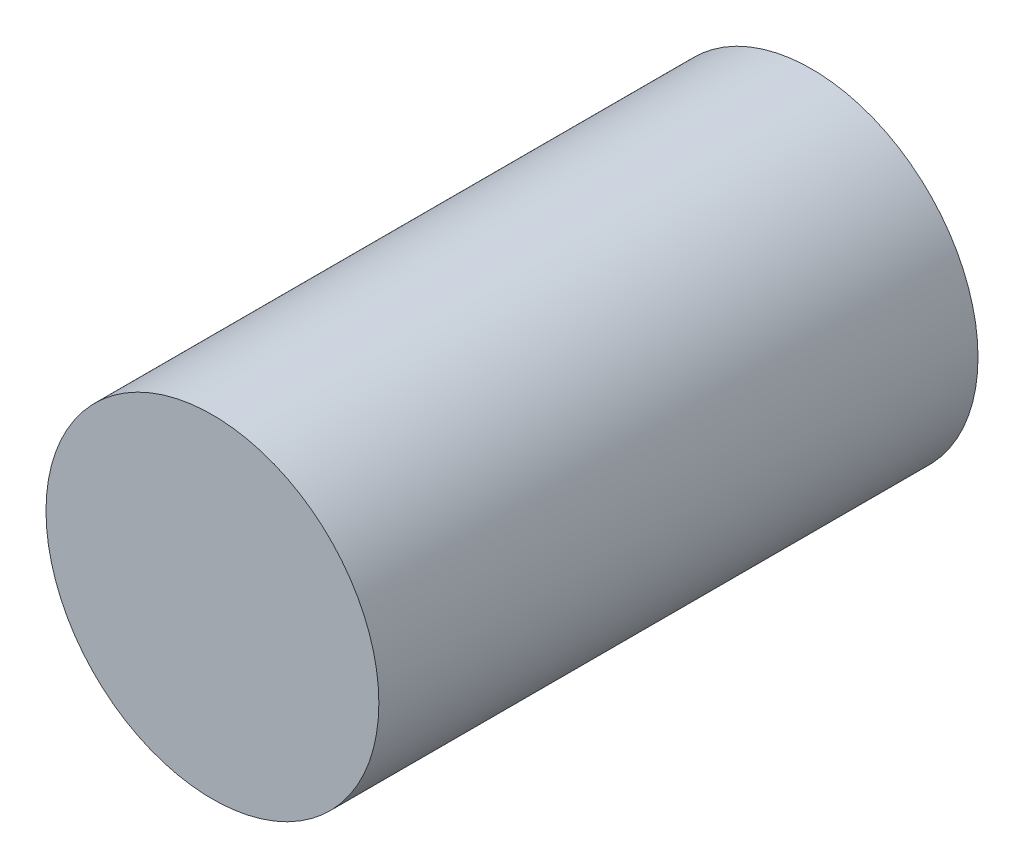
from build123d import *

# Parameters (mm, degrees)
SKETCH_1_R      = 5
EXTRUDE_1_DEPTH = 18


with BuildPart() as part:
    # 草圖1 → 填料-伸長1 (new body)
    with BuildSketch(Plane.XY):
        Circle(SKETCH_1_R)
    extrude(amount=EXTRUDE_1_DEPTH)


solid = part.part
